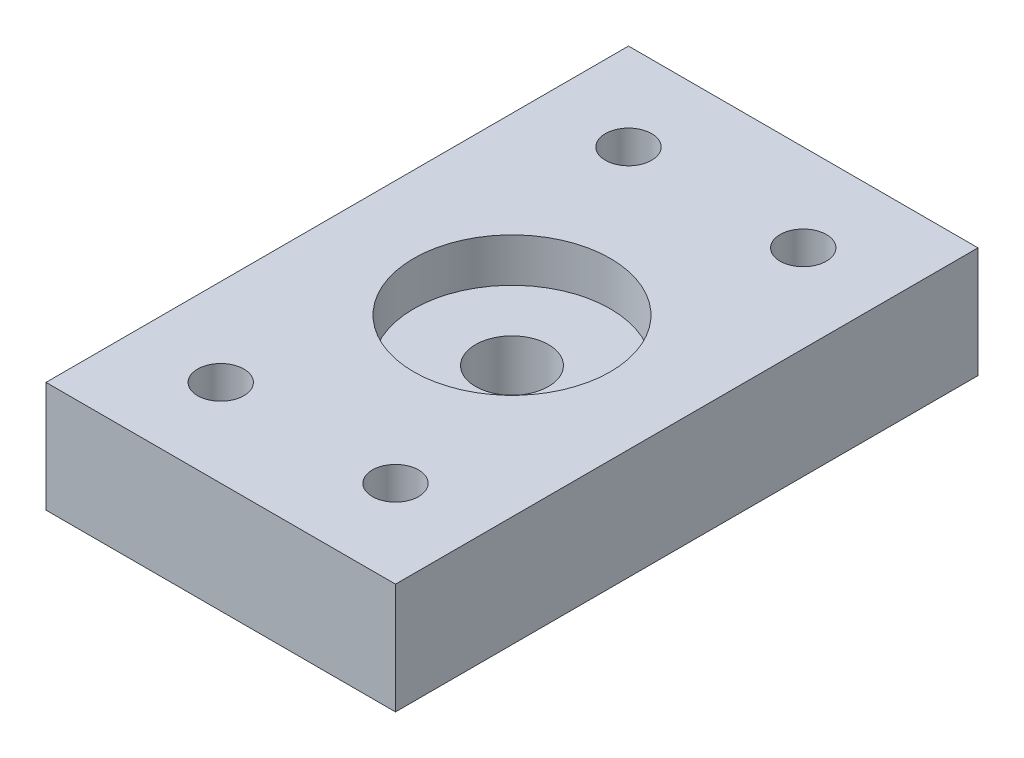
from build123d import *

# Parameters (mm, degrees)
SKETCH1_W                    = 76.2
SKETCH1_H                    = 127
BOSS_EXTRUDE1_DEPTH          = 24.13
SKETCH2_R                    = 7.9375
F_1_2_13_THREADED_HOLE_DEPTH = 78.885280381
SKETCH3_R                    = 5.0419
F_3_8_THROUGH_HOLES_DEPTH    = 78.885280381
SKETCH4_R                    = 21.43125
CUT_EXTRUDE1_DEPTH           = 9.525


with BuildPart() as part:
    # Sketch1 → Boss-Extrude1 (new body)
    with BuildSketch(Plane(origin=(0, 0, 0), x_dir=(1, 0, 0), z_dir=(0, 1, 0))):
        Rectangle(SKETCH1_W, SKETCH1_H)
    extrude(amount=BOSS_EXTRUDE1_DEPTH)

    # Sketch2 → 1/2"-13 Threaded Hole (cut, through all)
    with BuildSketch(Plane(origin=(0, 24.13, 0), x_dir=(1, 0, 0), z_dir=(0, 1, 0))):
        with Locations(Location((0, 0, 0), (0, 0, 270))):
            Circle(SKETCH2_R)
    extrude(amount=-F_1_2_13_THREADED_HOLE_DEPTH, mode=Mode.SUBTRACT)

    # Sketch3 → 3/8" Through Holes (cut, through all)
    with BuildSketch(Plane(origin=(0, 24.13, 0), x_dir=(1, 0, 0), z_dir=(0, 1, 0))):
        with Locations(Location((-19.05, 44.45, 0), (0, 0, 270))):
            Circle(SKETCH3_R)
        with Locations(Location((19.05, 44.45, 0), (0, 0, 270))):
            Circle(SKETCH3_R)
        with Locations(Location((19.05, -44.45, 0), (0, 0, 270))):
            Circle(SKETCH3_R)
        with Locations(Location((-19.05, -44.45, 0), (0, 0, 270))):
            Circle(SKETCH3_R)
    extrude(amount=-F_3_8_THROUGH_HOLES_DEPTH, mode=Mode.SUBTRACT)

    # Sketch4 → Cut-Extrude1 (cut)
    with BuildSketch(Plane(origin=(0, 24.13, 0), x_dir=(1, 0, 0), z_dir=(0, 1, 0))):
        with Locations(Location((0, 0, 0), (0, 0, 270))):
            Circle(SKETCH4_R)
    extrude(amount=-CUT_EXTRUDE1_DEPTH, mode=Mode.SUBTRACT)


solid = part.part
